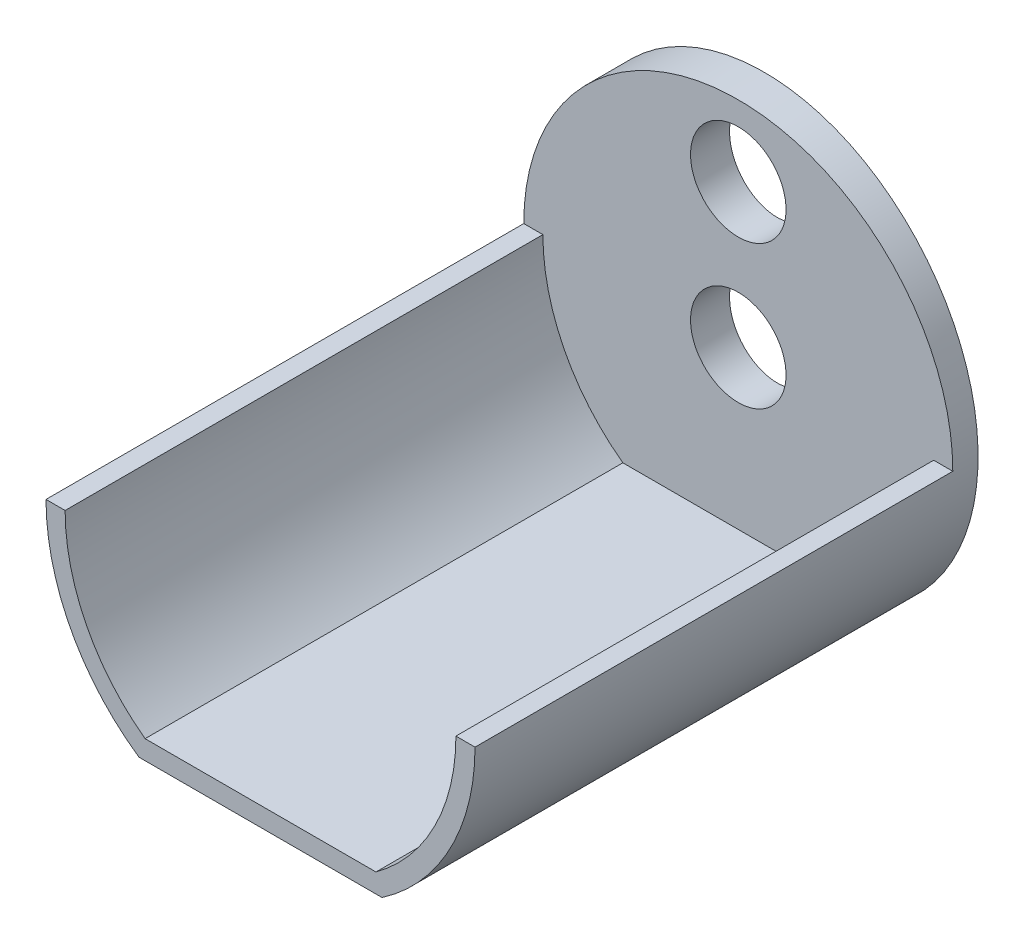
from build123d import *

# Parameters (mm, degrees)
SKETCH1_R               = 22.45
BOSS_EXTRUDE1_DEPTH     = 5
SKETCH2_R               = 5
CUT_EXTRUDE1_DEPTH      = 5
BOSS_EXTRUDE2_DEPTH     = 50
BOSS_EXTRUDE5_DEPTH     = 50
CUT_EXTRUDE3_DEPTH      = 64.505944604
CUT_EXTRUDE3_DEPTH_BACK = 64.505944604


with BuildPart() as part:
    # Sketch1 → Boss-Extrude1 (new body)
    with BuildSketch(Plane.XY):
        Circle(SKETCH1_R)
    extrude(amount=BOSS_EXTRUDE1_DEPTH)

    # Sketch2 → Cut-Extrude1 (cut)
    with BuildSketch(Plane(origin=(0, 0, 0), x_dir=(-1, 0, 0), z_dir=(0, 0, -1))):
        Circle(SKETCH2_R)
        with Locations((0, 15)):
            Circle(SKETCH2_R)
    extrude(amount=-CUT_EXTRUDE1_DEPTH, mode=Mode.SUBTRACT)

    # Sketch3 → Boss-Extrude2 (add)
    with BuildSketch(Plane.XY.offset(5)):
        with BuildLine():
            Line((-12.718195627, -18.5), (12.718195627, -18.5))
            ThreePointArc((12.718195627, -18.5), (14.006550731, -17.544772344), (15.223419458, -16.5))
            Line((15.223419458, -16.5), (-15.223419458, -16.5))
            ThreePointArc((-15.223419458, -16.5), (-14.006550731, -17.544772344), (-12.718195627, -18.5))
        make_face()
    extrude(amount=BOSS_EXTRUDE2_DEPTH)

    # Sketch5 → Boss-Extrude5 (add)
    with BuildSketch(Plane.XY.offset(5)):
        with BuildLine():
            Line((-15.223419458, -16.5), (-12.08108025, -16.5))
            ThreePointArc((-12.08108025, -16.5), (-12.994947259, -15.790308602), (-13.867212825, -15.030066815))
            ThreePointArc((-13.867212825, -15.030066815), (-18.732151535, -8.204206169), (-20.45, 0))
            Line((-20.45, 0), (-22.45, 0))
            ThreePointArc((-22.45, 0), (-20.564146795, -9.006573521), (-15.223419458, -16.5))
        make_face()
        with BuildLine():
            Line((20.45, 0), (22.45, 0))
            ThreePointArc((22.45, 0), (20.564146795, -9.006573521), (15.223419458, -16.5))
            Line((15.223419458, -16.5), (12.08108025, -16.5))
            ThreePointArc((12.08108025, -16.5), (12.994947259, -15.790308602), (13.867212825, -15.030066815))
            ThreePointArc((13.867212825, -15.030066815), (18.732151535, -8.204206169), (20.45, 0))
        make_face()
    extrude(amount=BOSS_EXTRUDE5_DEPTH)

    # Sketch6 → Cut-Extrude3 (cut, two sides: drawn at the far end of the back side and taken through both)
    with BuildSketch(Plane(origin=(0, 0, 0), x_dir=(1, 0, 0), z_dir=(0, 1, 0)).offset(-CUT_EXTRUDE3_DEPTH_BACK)):
        Polygon((-22.45, 0), (22.45, 0), (22.45, -2.35310929), align=None)
    extrude(amount=CUT_EXTRUDE3_DEPTH + CUT_EXTRUDE3_DEPTH_BACK, mode=Mode.SUBTRACT)


solid = part.part
